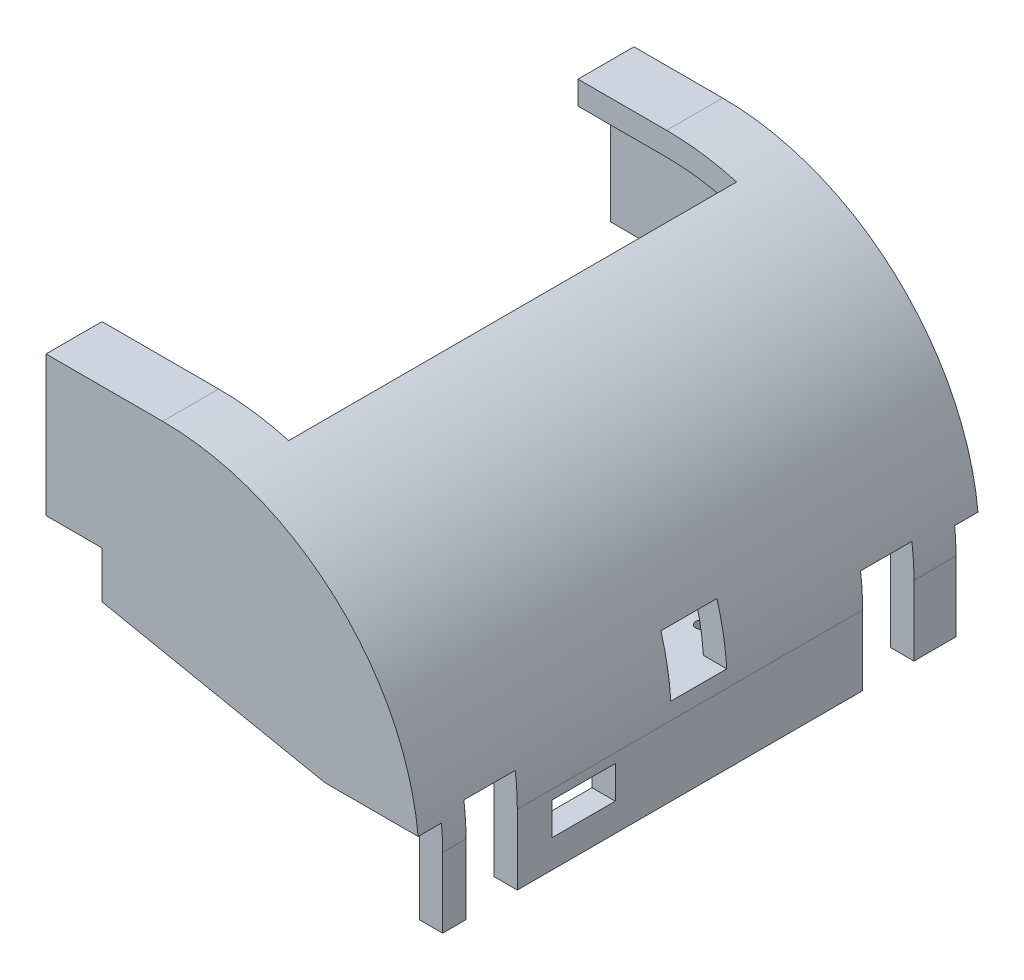
from build123d import *

# Parameters (mm, degrees)
BOSS_EXTRUDE1_DEPTH     = 110
SKETCH2_W               = 30
SKETCH2_H               = 12.5
BOSS_EXTRUDE2_DEPTH     = 35
SKETCH3_R               = 8
CUT_EXTRUDE1_DEPTH      = 121.603742452
SKETCH4_R               = 1.5
SKETCH4_R_2             = 1.25
CUT_EXTRUDE2_DEPTH      = 12.5
SKETCH5_W               = 9.5
SKETCH5_H               = 12.5
CUT_EXTRUDE3_DEPTH      = 121.603742452
FILLET4_R               = 0.5
BOSS_EXTRUDE3_DEPTH     = 5
CUT_EXTRUDE4_DEPTH      = 158.919156753
CUT_EXTRUDE4_DEPTH_BACK = 158.919156753
SKETCH7_W               = 12
SKETCH7_H               = 12
SKETCH7_W_2             = 11
SKETCH7_H_2             = 22
SKETCH7_W_3             = 13.6
SKETCH7_H_3             = 7
BOSS_EXTRUDE4_START     = 5
BOSS_EXTRUDE4_DEPTH     = 5
CUT_EXTRUDE5_DEPTH      = 152.478720037


with BuildPart() as part:
    # Sketch1 → Boss-Extrude1 (new body)
    with BuildSketch(Plane.XY):
        with BuildLine():
            Line((13.568, -0.541666667), (18.568, -0.541666667))
            Line((18.568, -0.541666667), (18.568, 14.458333333))
            ThreePointArc((18.568, 14.458333333), (2.458872965, 53.349206299), (-36.432, 69.458333333))
            Line((-36.432, 69.458333333), (-69.432, 69.458333333))
            Line((-69.432, 69.458333333), (-69.432, 64.458333333))
            Line((-69.432, 64.458333333), (-36.432, 64.458333333))
            ThreePointArc((-36.432, 64.458333333), (-1.076660941, 49.813672393), (13.568, 14.458333333))
            Line((13.568, 14.458333333), (13.568, -0.541666667))
        make_face()
    extrude(amount=BOSS_EXTRUDE1_DEPTH)

    # Sketch2 → Boss-Extrude2 (add)
    with BuildSketch(Plane.ZY.offset(-13.568)):
        with Locations((55, 11.708333333)):
            Rectangle(SKETCH2_W, SKETCH2_H)
    extrude(amount=BOSS_EXTRUDE2_DEPTH)

    # Sketch3 → Cut-Extrude1 (cut, through all)
    with BuildSketch(Plane(origin=(0, 0, 40), x_dir=(-1, 0, 0), z_dir=(0, 0, -1))):
        with Locations((3.932, 5.458333333)):
            Circle(SKETCH3_R)
    extrude(amount=-CUT_EXTRUDE1_DEPTH, mode=Mode.SUBTRACT)

    # Sketch4 → Cut-Extrude2 (cut)
    with BuildSketch(Plane.XZ.offset(-5.458333333)):
        with Locations(Location((-17.932, 43.5, 0), (0, 0, 270))):
            Circle(SKETCH4_R)
        with Locations(Location((-17.932, 66.5, 0), (0, 0, 270))):
            Circle(SKETCH4_R)
        with Locations(Location((7.568, 43.5, 0), (0, 0, 270))):
            Circle(SKETCH4_R_2)
        with Locations(Location((7.568, 66.5, 0), (0, 0, 270))):
            Circle(SKETCH4_R_2)
    extrude(amount=-CUT_EXTRUDE2_DEPTH, mode=Mode.SUBTRACT)

    # Sketch5 → Cut-Extrude3 (cut, through all)
    with BuildSketch(Plane(origin=(0, 0, 40), x_dir=(-1, 0, 0), z_dir=(0, 0, -1))):
        with Locations((16.682, 11.708333333)):
            Rectangle(SKETCH5_W, SKETCH5_H)
    extrude(amount=-CUT_EXTRUDE3_DEPTH, mode=Mode.SUBTRACT)

    # Fillet4
    fillet4_edges = [part.edges().sort_by_distance(p)[0] for p in [
        (-11.932, 5.458333333, 55),
    ]]
    fillet(fillet4_edges, radius=FILLET4_R)

    # Sketch6 → Boss-Extrude3 (add)
    with BuildSketch(Plane.XY.offset(110)):
        with BuildLine():
            Line((18.310426703, 19.774978769), (-1.689573297, 19.774978769))
            Line((-1.689573297, 19.774978769), (-49.432, 29.458333333))
            Line((-49.432, 29.458333333), (-49.432, 39.458333333))
            Line((-49.432, 39.458333333), (-69.432, 39.458333333))
            Line((-69.432, 39.458333333), (-69.432, 69.458333333))
            Line((-69.432, 69.458333333), (-36.432, 69.458333333))
            ThreePointArc((-36.432, 69.458333333), (0.531390679, 55.1855693), (18.310426703, 19.774978769))
        make_face()
    extrude(amount=BOSS_EXTRUDE3_DEPTH)

    # Sketch7 → Cut-Extrude4 (cut, two sides: drawn at the far end of the back side and taken through both)
    with BuildSketch(Plane.ZY.offset(-13.568).offset(-CUT_EXTRUDE4_DEPTH_BACK)):
        with Locations((55, 23.958333333)):
            Rectangle(SKETCH7_W, SKETCH7_H)
        with Locations((99.5, 10.458333333)):
            Rectangle(SKETCH7_W_2, SKETCH7_H_2)
        with Locations((14.5, 10.458333333)):
            Rectangle(SKETCH7_W_2, SKETCH7_H_2)
        with Locations((79.8, 8.958333333)):
            Rectangle(SKETCH7_W_3, SKETCH7_H_3)
    extrude(amount=CUT_EXTRUDE4_DEPTH + CUT_EXTRUDE4_DEPTH_BACK, mode=Mode.SUBTRACT)

    # Sketch8 → Boss-Extrude4 (add)
    with BuildSketch(Plane(origin=(0, 0, 0), x_dir=(-1, 0, 0), z_dir=(0, 0, -1)).offset(BOSS_EXTRUDE4_START)):
        with BuildLine():
            Line((36.432, 69.458333333), (69.432, 69.458333333))
            Line((69.432, 69.458333333), (69.432, 64.458333333))
            Line((69.432, 64.458333333), (69.432, 39.458333333))
            Line((69.432, 39.458333333), (49.432, 39.458333333))
            Line((49.432, 39.458333333), (49.432, 29.458333333))
            Line((49.432, 29.458333333), (1.707690959, 19.958333333))
            Line((1.707690959, 19.958333333), (-18.292309041, 19.958333333))
            ThreePointArc((-18.292309041, 19.958333333), (-0.463121629, 55.247425012), (36.432, 69.458333333))
        make_face()
    extrude(amount=-BOSS_EXTRUDE4_DEPTH)

    # Sketch9 → Cut-Extrude5 (cut, through all)
    with BuildSketch(Plane(origin=(0, 69.458333333, 0), x_dir=(1, 0, 0), z_dir=(0, 1, 0))):
        Polygon((-55.432, -7), (-21.432, -7), (-21.432, -103), (-61.432, -103), (-61.432, -133.715891386), (-92.425116466, -133.715891386), (-92.425116466, -103), (-92.425116466, -7), (-92.425116466, 8.214128056), (-55.432, 8.214128056), align=None)
    extrude(amount=-CUT_EXTRUDE5_DEPTH, mode=Mode.SUBTRACT)


solid = part.part
